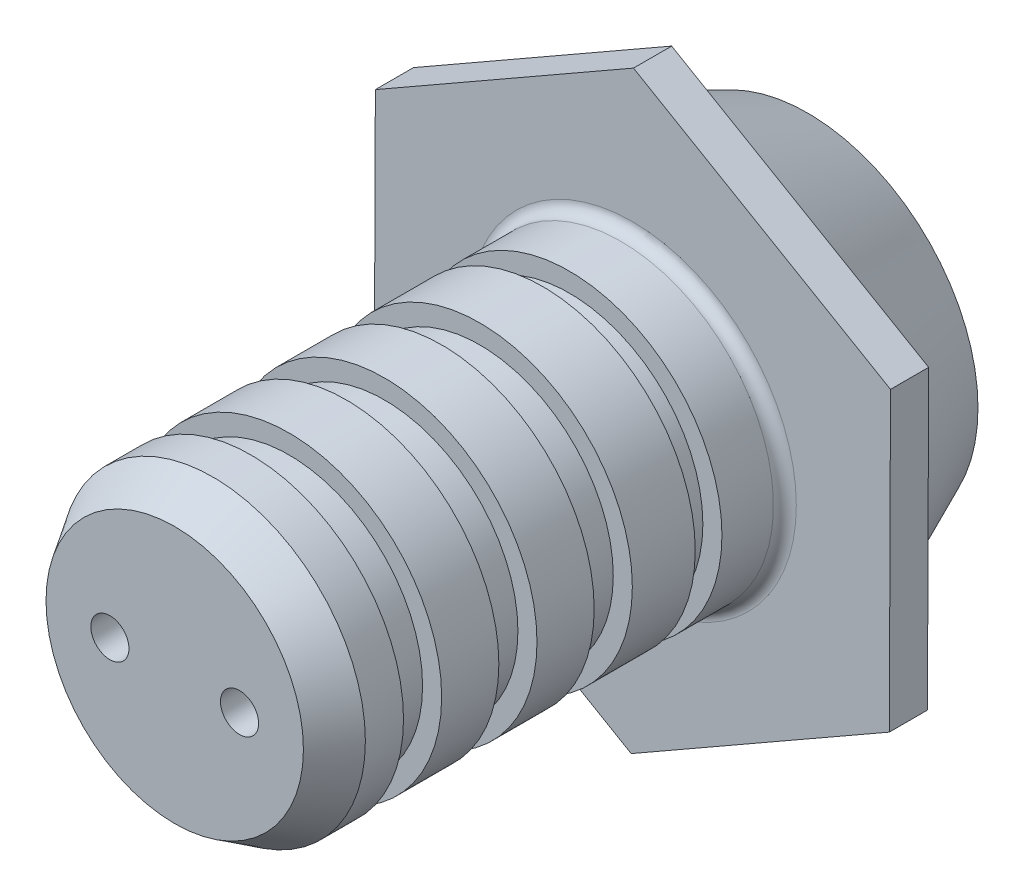
from build123d import *

# Parameters (mm, degrees)
SKETCH1_R           = 4
BOSS_EXTRUDE1_DEPTH = 11
SKETCH9_R           = 4
SKETCH9_R_2         = 3.5
CUT_EXTRUDE6_DEPTH  = 0.35
SKETCH10_R          = 4
SKETCH10_R_2        = 3.5
CUT_EXTRUDE7_DEPTH  = 0.5
SKETCH11_R          = 4
SKETCH11_R_2        = 3.5
CUT_EXTRUDE8_DEPTH  = 0.5
SKETCH12_R          = 4
SKETCH12_R_2        = 3.5
CUT_EXTRUDE9_DEPTH  = 0.5
BOSS_EXTRUDE5_DEPTH = 1
FILLET2_R           = 0.3
SKETCH21_R          = 0.3
SKETCH26_R          = 5.8
BOSS_EXTRUDE6_DEPTH = 3
BOSS_EXTRUDE6_DRAFT = -24
SKETCH27_R          = 4
BOSS_EXTRUDE7_DEPTH = 1
BOSS_EXTRUDE7_TAPER = 32
SHELL1_T            = -0.5
SKETCH29_R          = 0.5
CUT_EXTRUDE11_DEPTH = 1


with BuildPart() as part:
    # Sketch1 → Boss-Extrude1 (new body)
    with BuildSketch(Plane.XY):
        Circle(SKETCH1_R)
    extrude(amount=BOSS_EXTRUDE1_DEPTH)

    # Sketch9 → Cut-Extrude6 (cut, symmetric)
    with BuildSketch(Plane.XY.offset(2)):
        Circle(SKETCH9_R)
        Circle(SKETCH9_R_2, mode=Mode.SUBTRACT)
    extrude(amount=CUT_EXTRUDE6_DEPTH, both=True, mode=Mode.SUBTRACT)

    # Sketch10 → Cut-Extrude7 (cut, symmetric)
    with BuildSketch(Plane.XY.offset(4.5)):
        Circle(SKETCH10_R)
        Circle(SKETCH10_R_2, mode=Mode.SUBTRACT)
    extrude(amount=CUT_EXTRUDE7_DEPTH, both=True, mode=Mode.SUBTRACT)

    # Sketch11 → Cut-Extrude8 (cut, symmetric)
    with BuildSketch(Plane.XY.offset(7)):
        Circle(SKETCH11_R)
        Circle(SKETCH11_R_2, mode=Mode.SUBTRACT)
    extrude(amount=CUT_EXTRUDE8_DEPTH, both=True, mode=Mode.SUBTRACT)

    # Sketch12 → Cut-Extrude9 (cut, symmetric)
    with BuildSketch(Plane.XY.offset(9.5)):
        Circle(SKETCH12_R)
        Circle(SKETCH12_R_2, mode=Mode.SUBTRACT)
    extrude(amount=CUT_EXTRUDE9_DEPTH, both=True, mode=Mode.SUBTRACT)

    # Sketch15 → Boss-Extrude5 (add)
    with BuildSketch(Plane(origin=(0, 0, 0), x_dir=(-1, 0, 0), z_dir=(0, 0, -1))):
        Polygon((6.738957478, 3.926210652), (-0.030719426, 7.799213697), (-6.769676904, 3.873003045), (-6.738957478, -3.926210652), (0.030719426, -7.799213697), (6.769676904, -3.873003045), align=None)
    extrude(amount=BOSS_EXTRUDE5_DEPTH)

    # Fillet2
    fillet2_edges = [part.edges().sort_by_distance(p)[0] for p in [
        (-4, 0, 0),
    ]]
    fillet(fillet2_edges, radius=FILLET2_R)

    # Sketch27 → Boss-Extrude7 (add)
    with BuildSketch(Plane.XY.offset(11)):
        Circle(SKETCH27_R)
    extrude(amount=BOSS_EXTRUDE7_DEPTH, taper=BOSS_EXTRUDE7_TAPER)

    # Sketch29 → Cut-Extrude11 (cut)
    with BuildSketch(Plane.XY.offset(12)):
        with Locations((-1.7, 0)):
            Circle(SKETCH29_R)
        with Locations((1.7, 0)):
            Circle(SKETCH29_R)
    extrude(amount=-CUT_EXTRUDE11_DEPTH, mode=Mode.SUBTRACT)


with BuildPart() as body_2:
    # Sweep2: sweep along a path in Sketch25
    with BuildLine(Plane.XY.offset(-1.3)) as sweep2_path:
        CenterArc((0, 0), 5.8, 0, 360)
    # Sketch21 → Sweep2 (sweep)
    with BuildSketch(Plane(origin=(0, 0, 0), x_dir=(1, 0, 0), z_dir=(0, 1, 0))):
        with Locations((-5.8, 1.301051392)):
            Circle(SKETCH21_R)
    sweep(path=sweep2_path.line)


with BuildPart() as boss_extrude6_tool:
    # Sketch26 → Boss-Extrude6 (with draft: the straight prism first)
    with BuildSketch(Plane.XY.offset(-1.6)):
        Circle(SKETCH26_R)
    extrude(amount=-BOSS_EXTRUDE6_DEPTH)
    # Boss-Extrude6: the draft: its side faces are tilted about the plane it starts from
    boss_extrude6_sides = [boss_extrude6_tool.faces().sort_by_distance(p)[0] for p in [
        (-5.8, 0, -3.1),
    ]]
    draft(boss_extrude6_sides, Plane.XY.offset(-1.6), BOSS_EXTRUDE6_DRAFT)


with BuildPart() as body_2_1:
    add(body_2.part)

    # Boss-Extrude6: add boss_extrude6_tool
    add(boss_extrude6_tool.part)

    # Shell1
    shell1_openings = [body_2_1.faces().sort_by_distance(p)[0] for p in [
        (0, 0, -4.6),
    ]]
    offset(amount=SHELL1_T, openings=shell1_openings, kind=Kind.INTERSECTION)

    # Sketch28 → Revolve2 (revolve)
    with BuildSketch(Plane(origin=(0, 0, 0), x_dir=(1, 0, 0), z_dir=(0, 1, 0))):
        with BuildLine():
            Line((0, 1.519073709), (0, 4.713628159))
            add(Edge.make_bspline(
                [(0, 4.713628159), (-2.499815532, 4.713628159), (-2.499815532, 1.519073709)],
                knots=[0, 0, 0, 1.570796327, 1.570796327, 1.570796327], degree=2, weights=[1, 0.707106781, 1]))
            Line((-2.499815532, 1.519073709), (0, 1.519073709))
        make_face()
    revolve(axis=Axis((0, 0, -6.966468364), (0, 0, 1)))


solid = Compound([part.part, body_2_1.part])
